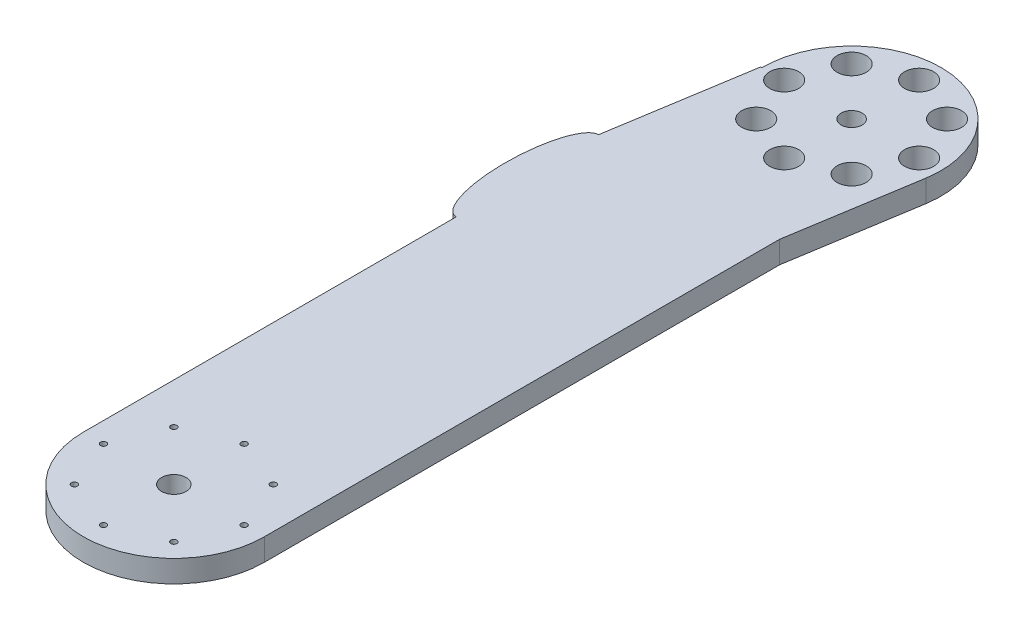
from build123d import *

# Parameters (mm, degrees)
RESSALTO_EXTRUS_O1_DEPTH = 10
CORTE_EXTRUS_O8_REACH    = 341.935
ESBO_O7_R                = 1.35
CORTE_EXTRUS_O9_REACH    = 341.935
ESBO_O8_R                = 5.5
CORTE_EXTRUS_O11_REACH   = 341.935
ESBO_O9_R                = 6.561250056
CORTE_EXTRUS_O12_REACH   = 341.935
ESBO_O11_R               = 4.721038774


with BuildPart() as part:
    # Esboço1 → Ressalto-extrusão1 (new body)
    with BuildSketch(Plane(origin=(0, 0, 0), x_dir=(1, 0, 0), z_dir=(0, 1, 0))):
        with BuildLine():
            Line((-40.84210038, 168.234723208), (-40.84210038, 0))
            ThreePointArc((-40.84210038, 0), (0, -40.84210038), (40.84210038, 0))
            Line((40.84210038, 0), (40.84210038, 232.431468171))
            Line((40.84210038, 232.431468171), (49.944742048, 289.240794792))
            ThreePointArc((49.944742048, 289.240794792), (13.221316983, 335.82982291), (-30.202173842, 295.412649158))
            Line((-30.202173842, 295.412649158), (-30.75098815, 295.409811333))
            Line((-30.75098815, 295.409811333), (-40.84210038, 232.431468171))
            add(Edge.make_bspline(
                [(-40.84210038, 232.431468171), (-50.93321261, 232.431468171), (-50.93321261, 200.333095689), (-50.93321261, 168.234723208), (-40.84210038, 168.234723208)],
                knots=[0, 0, 0, 1.570796327, 1.570796327, 3.141592654, 3.141592654, 3.141592654], degree=2, weights=[1, 0.707106781, 1, 0.707106781, 1]))
        make_face()
    extrude(amount=RESSALTO_EXTRUS_O1_DEPTH)

    # Esboço7 → Corte-extrusão8 (cut, up to next)
    with BuildSketch(Plane.XZ, mode=Mode.PRIVATE) as corte_extrus_o8_sk1:
        with Locations(Location((0, -31.716755633, 0), (0, 0, 270))):
            Circle(ESBO_O7_R)
    corte_extrus_o8_tool1 = extrude(corte_extrus_o8_sk1.sketch, amount=-CORTE_EXTRUS_O8_REACH, mode=Mode.PRIVATE) & part.part
    # Esboço7 → Corte-extrusão8 (cut, up to next)
    with BuildSketch(Plane.XZ, mode=Mode.PRIVATE) as corte_extrus_o8_sk2:
        with Locations(Location((-22.427132985, -22.427132985, 0), (0, 0, 270))):
            Circle(ESBO_O7_R)
    corte_extrus_o8_tool2 = extrude(corte_extrus_o8_sk2.sketch, amount=-CORTE_EXTRUS_O8_REACH, mode=Mode.PRIVATE) & part.part
    # Esboço7 → Corte-extrusão8 (cut, up to next)
    with BuildSketch(Plane.XZ, mode=Mode.PRIVATE) as corte_extrus_o8_sk3:
        with Locations(Location((-31.716755633, 0, 0), (0, 0, 270))):
            Circle(ESBO_O7_R)
    corte_extrus_o8_tool3 = extrude(corte_extrus_o8_sk3.sketch, amount=-CORTE_EXTRUS_O8_REACH, mode=Mode.PRIVATE) & part.part
    # Esboço7 → Corte-extrusão8 (cut, up to next)
    with BuildSketch(Plane.XZ, mode=Mode.PRIVATE) as corte_extrus_o8_sk4:
        with Locations(Location((-22.427132985, 22.427132985, 0), (0, 0, 270))):
            Circle(ESBO_O7_R)
    corte_extrus_o8_tool4 = extrude(corte_extrus_o8_sk4.sketch, amount=-CORTE_EXTRUS_O8_REACH, mode=Mode.PRIVATE) & part.part
    # Esboço7 → Corte-extrusão8 (cut, up to next)
    with BuildSketch(Plane.XZ, mode=Mode.PRIVATE) as corte_extrus_o8_sk5:
        with Locations(Location((0, 31.716755633, 0), (0, 0, 270))):
            Circle(ESBO_O7_R)
    corte_extrus_o8_tool5 = extrude(corte_extrus_o8_sk5.sketch, amount=-CORTE_EXTRUS_O8_REACH, mode=Mode.PRIVATE) & part.part
    # Esboço7 → Corte-extrusão8 (cut, up to next)
    with BuildSketch(Plane.XZ, mode=Mode.PRIVATE) as corte_extrus_o8_sk6:
        with Locations(Location((22.427132985, 22.427132985, 0), (0, 0, 270))):
            Circle(ESBO_O7_R)
    corte_extrus_o8_tool6 = extrude(corte_extrus_o8_sk6.sketch, amount=-CORTE_EXTRUS_O8_REACH, mode=Mode.PRIVATE) & part.part
    # Esboço7 → Corte-extrusão8 (cut, up to next)
    with BuildSketch(Plane.XZ, mode=Mode.PRIVATE) as corte_extrus_o8_sk7:
        with Locations(Location((31.716755633, 0, 0), (0, 0, 270))):
            Circle(ESBO_O7_R)
    corte_extrus_o8_tool7 = extrude(corte_extrus_o8_sk7.sketch, amount=-CORTE_EXTRUS_O8_REACH, mode=Mode.PRIVATE) & part.part
    # Esboço7 → Corte-extrusão8 (cut, up to next)
    with BuildSketch(Plane.XZ, mode=Mode.PRIVATE) as corte_extrus_o8_sk8:
        with Locations(Location((22.427132985, -22.427132985, 0), (0, 0, 270))):
            Circle(ESBO_O7_R)
    corte_extrus_o8_tool8 = extrude(corte_extrus_o8_sk8.sketch, amount=-CORTE_EXTRUS_O8_REACH, mode=Mode.PRIVATE) & part.part
    add(corte_extrus_o8_tool1.solids().sort_by_distance((0, 0, -31.716756))[0], mode=Mode.SUBTRACT)
    add(corte_extrus_o8_tool2.solids().sort_by_distance((-22.427133, 0, -22.427133))[0], mode=Mode.SUBTRACT)
    add(corte_extrus_o8_tool3.solids().sort_by_distance((-31.716756, 0, 0))[0], mode=Mode.SUBTRACT)
    add(corte_extrus_o8_tool4.solids().sort_by_distance((-22.427133, 0, 22.427133))[0], mode=Mode.SUBTRACT)
    add(corte_extrus_o8_tool5.solids().sort_by_distance((0, 0, 31.716756))[0], mode=Mode.SUBTRACT)
    add(corte_extrus_o8_tool6.solids().sort_by_distance((22.427133, 0, 22.427133))[0], mode=Mode.SUBTRACT)
    add(corte_extrus_o8_tool7.solids().sort_by_distance((31.716756, 0, 0))[0], mode=Mode.SUBTRACT)
    add(corte_extrus_o8_tool8.solids().sort_by_distance((22.427133, 0, -22.427133))[0], mode=Mode.SUBTRACT)

    # Esboço8 → Corte-extrusão9 (cut, up to next)
    with BuildSketch(Plane(origin=(0, 10, 0), x_dir=(1, 0, 0), z_dir=(0, 1, 0)), mode=Mode.PRIVATE) as corte_extrus_o9_sk1:
        with Locations(Location((0, 0, 0), (0, 0, 270))):
            Circle(ESBO_O8_R)
    corte_extrus_o9_tool1 = extrude(corte_extrus_o9_sk1.sketch, amount=-CORTE_EXTRUS_O9_REACH, mode=Mode.PRIVATE) & part.part
    add(corte_extrus_o9_tool1.solids().sort_by_distance((0, 10, 0))[0], mode=Mode.SUBTRACT)

    # Esboço9 → Corte-extrusão11 (cut, up to next)
    with BuildSketch(Plane(origin=(0, 10, 0), x_dir=(1, 0, 0), z_dir=(0, 1, 0)), mode=Mode.PRIVATE) as corte_extrus_o11_sk1:
        with Locations(Location((10.124979183, 326.05168837, 0), (0, 0, 270))):
            Circle(ESBO_O9_R)
    corte_extrus_o11_tool1 = extrude(corte_extrus_o11_sk1.sketch, amount=-CORTE_EXTRUS_O11_REACH, mode=Mode.PRIVATE) & part.part
    # Esboço9 → Corte-extrusão11 (cut, up to next)
    with BuildSketch(Plane(origin=(0, 10, 0), x_dir=(1, 0, 0), z_dir=(0, 1, 0)), mode=Mode.PRIVATE) as corte_extrus_o11_sk2:
        with Locations(Location((31.642602238, 317.13879707, 0), (0, 0, 270))):
            Circle(ESBO_O9_R)
    corte_extrus_o11_tool2 = extrude(corte_extrus_o11_sk2.sketch, amount=-CORTE_EXTRUS_O11_REACH, mode=Mode.PRIVATE) & part.part
    # Esboço9 → Corte-extrusão11 (cut, up to next)
    with BuildSketch(Plane(origin=(0, 10, 0), x_dir=(1, 0, 0), z_dir=(0, 1, 0)), mode=Mode.PRIVATE) as corte_extrus_o11_sk3:
        with Locations(Location((40.555493537, 295.621174015, 0), (0, 0, 270))):
            Circle(ESBO_O9_R)
    corte_extrus_o11_tool3 = extrude(corte_extrus_o11_sk3.sketch, amount=-CORTE_EXTRUS_O11_REACH, mode=Mode.PRIVATE) & part.part
    # Esboço9 → Corte-extrusão11 (cut, up to next)
    with BuildSketch(Plane(origin=(0, 10, 0), x_dir=(1, 0, 0), z_dir=(0, 1, 0)), mode=Mode.PRIVATE) as corte_extrus_o11_sk4:
        with Locations(Location((31.642602238, 274.10355096, 0), (0, 0, 270))):
            Circle(ESBO_O9_R)
    corte_extrus_o11_tool4 = extrude(corte_extrus_o11_sk4.sketch, amount=-CORTE_EXTRUS_O11_REACH, mode=Mode.PRIVATE) & part.part
    # Esboço9 → Corte-extrusão11 (cut, up to next)
    with BuildSketch(Plane(origin=(0, 10, 0), x_dir=(1, 0, 0), z_dir=(0, 1, 0)), mode=Mode.PRIVATE) as corte_extrus_o11_sk5:
        with Locations(Location((10.124979183, 265.190659661, 0), (0, 0, 270))):
            Circle(ESBO_O9_R)
    corte_extrus_o11_tool5 = extrude(corte_extrus_o11_sk5.sketch, amount=-CORTE_EXTRUS_O11_REACH, mode=Mode.PRIVATE) & part.part
    # Esboço9 → Corte-extrusão11 (cut, up to next)
    with BuildSketch(Plane(origin=(0, 10, 0), x_dir=(1, 0, 0), z_dir=(0, 1, 0)), mode=Mode.PRIVATE) as corte_extrus_o11_sk6:
        with Locations(Location((-11.392643872, 274.10355096, 0), (0, 0, 270))):
            Circle(ESBO_O9_R)
    corte_extrus_o11_tool6 = extrude(corte_extrus_o11_sk6.sketch, amount=-CORTE_EXTRUS_O11_REACH, mode=Mode.PRIVATE) & part.part
    # Esboço9 → Corte-extrusão11 (cut, up to next)
    with BuildSketch(Plane(origin=(0, 10, 0), x_dir=(1, 0, 0), z_dir=(0, 1, 0)), mode=Mode.PRIVATE) as corte_extrus_o11_sk7:
        with Locations(Location((-20.305535172, 295.621174015, 0), (0, 0, 270))):
            Circle(ESBO_O9_R)
    corte_extrus_o11_tool7 = extrude(corte_extrus_o11_sk7.sketch, amount=-CORTE_EXTRUS_O11_REACH, mode=Mode.PRIVATE) & part.part
    # Esboço9 → Corte-extrusão11 (cut, up to next)
    with BuildSketch(Plane(origin=(0, 10, 0), x_dir=(1, 0, 0), z_dir=(0, 1, 0)), mode=Mode.PRIVATE) as corte_extrus_o11_sk8:
        with Locations(Location((-11.392643872, 317.13879707, 0), (0, 0, 270))):
            Circle(ESBO_O9_R)
    corte_extrus_o11_tool8 = extrude(corte_extrus_o11_sk8.sketch, amount=-CORTE_EXTRUS_O11_REACH, mode=Mode.PRIVATE) & part.part
    add(corte_extrus_o11_tool1.solids().sort_by_distance((10.124979, 10, -326.051688))[0], mode=Mode.SUBTRACT)
    add(corte_extrus_o11_tool2.solids().sort_by_distance((31.642602, 10, -317.138797))[0], mode=Mode.SUBTRACT)
    add(corte_extrus_o11_tool3.solids().sort_by_distance((40.555494, 10, -295.621174))[0], mode=Mode.SUBTRACT)
    add(corte_extrus_o11_tool4.solids().sort_by_distance((31.642602, 10, -274.103551))[0], mode=Mode.SUBTRACT)
    add(corte_extrus_o11_tool5.solids().sort_by_distance((10.124979, 10, -265.19066))[0], mode=Mode.SUBTRACT)
    add(corte_extrus_o11_tool6.solids().sort_by_distance((-11.392644, 10, -274.103551))[0], mode=Mode.SUBTRACT)
    add(corte_extrus_o11_tool7.solids().sort_by_distance((-20.305535, 10, -295.621174))[0], mode=Mode.SUBTRACT)
    add(corte_extrus_o11_tool8.solids().sort_by_distance((-11.392644, 10, -317.138797))[0], mode=Mode.SUBTRACT)

    # Esboço11 → Corte-extrusão12 (cut, up to next)
    with BuildSketch(Plane(origin=(0, 10, 0), x_dir=(1, 0, 0), z_dir=(0, 1, 0)), mode=Mode.PRIVATE) as corte_extrus_o12_sk1:
        with Locations(Location((10.124979183, 295.621174015, 0), (0, 0, 270))):
            Circle(ESBO_O11_R)
    corte_extrus_o12_tool1 = extrude(corte_extrus_o12_sk1.sketch, amount=-CORTE_EXTRUS_O12_REACH, mode=Mode.PRIVATE) & part.part
    add(corte_extrus_o12_tool1.solids().sort_by_distance((10.124979, 10, -295.621174))[0], mode=Mode.SUBTRACT)


solid = part.part
